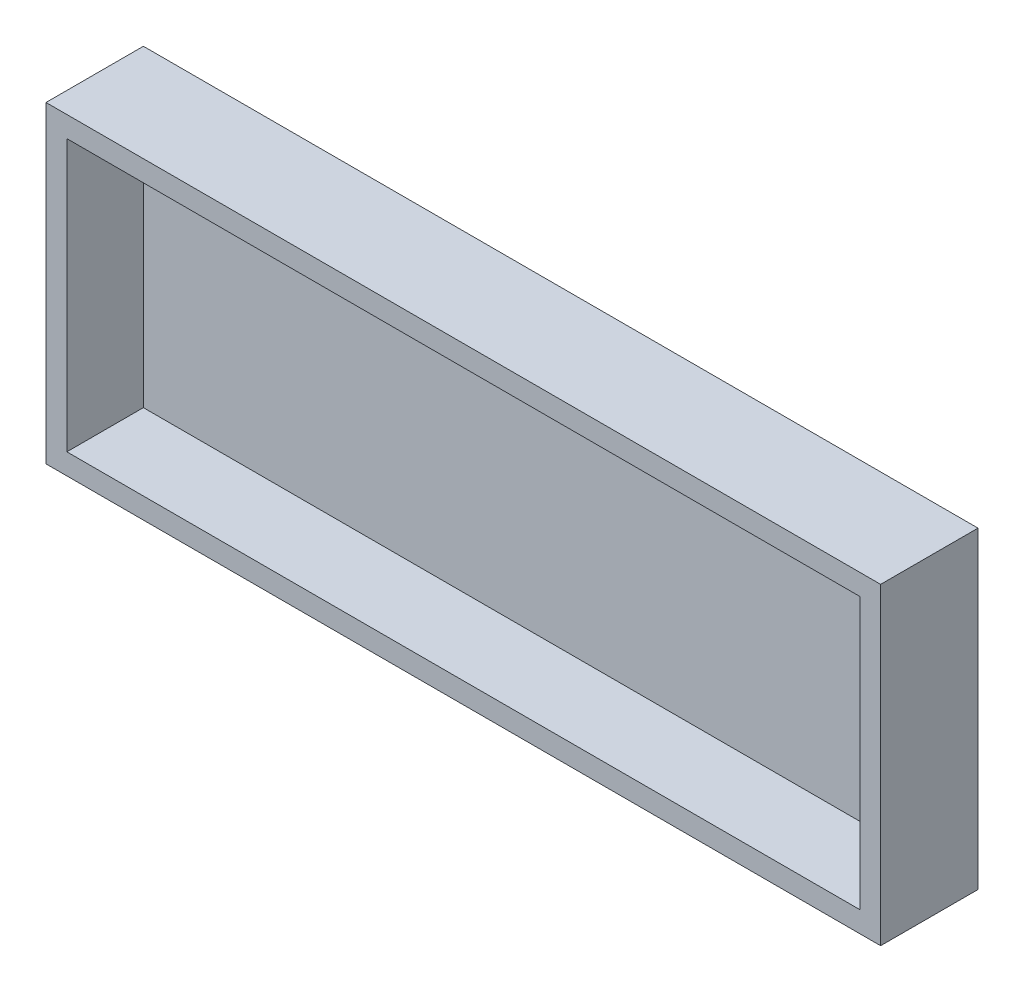
from build123d import *

# Parameters (mm, degrees)
SKETCH2_W           = 120
SKETCH2_H           = 45
BOSS_EXTRUDE2_DEPTH = 14
SHELL1_T            = -3


with BuildPart() as part:
    # Sketch2 → Boss-Extrude2 (new body)
    with BuildSketch(Plane.XY):
        Rectangle(SKETCH2_W, SKETCH2_H)
    extrude(amount=BOSS_EXTRUDE2_DEPTH)

    # Shell1
    shell1_openings = [part.faces().sort_by_distance(p)[0] for p in [
        (0, 0, 14),
    ]]
    offset(amount=SHELL1_T, openings=shell1_openings, kind=Kind.INTERSECTION)


solid = part.part
